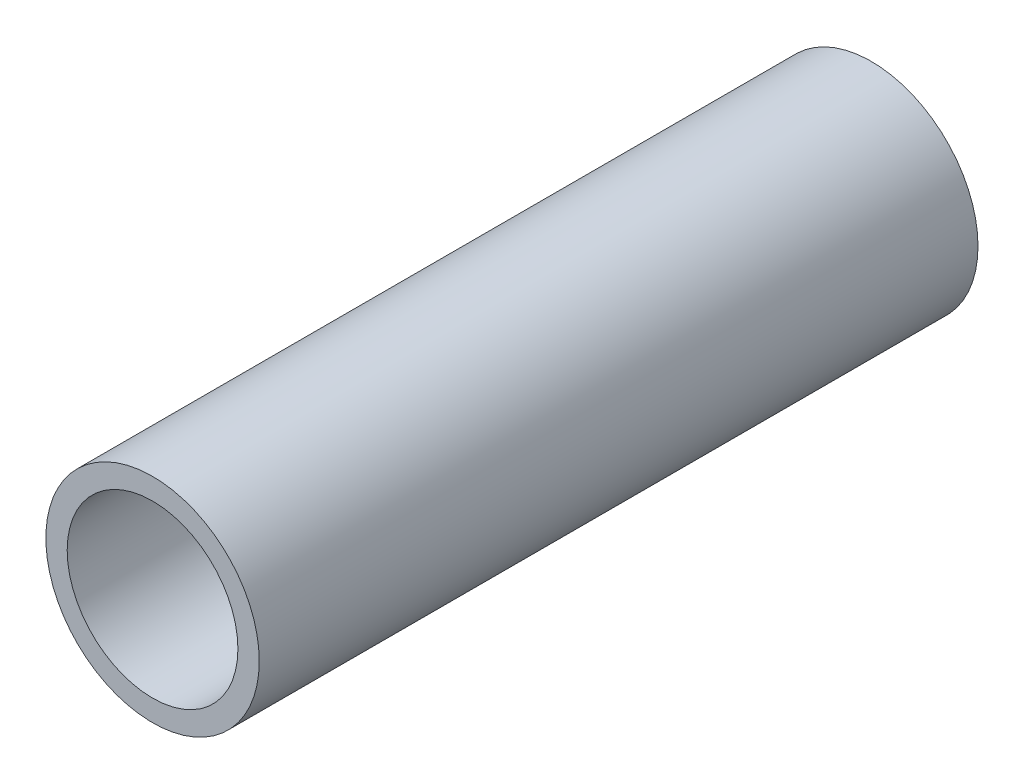
from build123d import *

# Parameters (mm, degrees)
SKETCH1_R           = 1.25
SKETCH1_R_2         = 1
BOSS_EXTRUDE1_DEPTH = 8.42


with BuildPart() as part:
    # Sketch1 → Boss-Extrude1 (new body)
    with BuildSketch(Plane.XY):
        Circle(SKETCH1_R)
        Circle(SKETCH1_R_2, mode=Mode.SUBTRACT)
    extrude(amount=BOSS_EXTRUDE1_DEPTH)


solid = part.part
